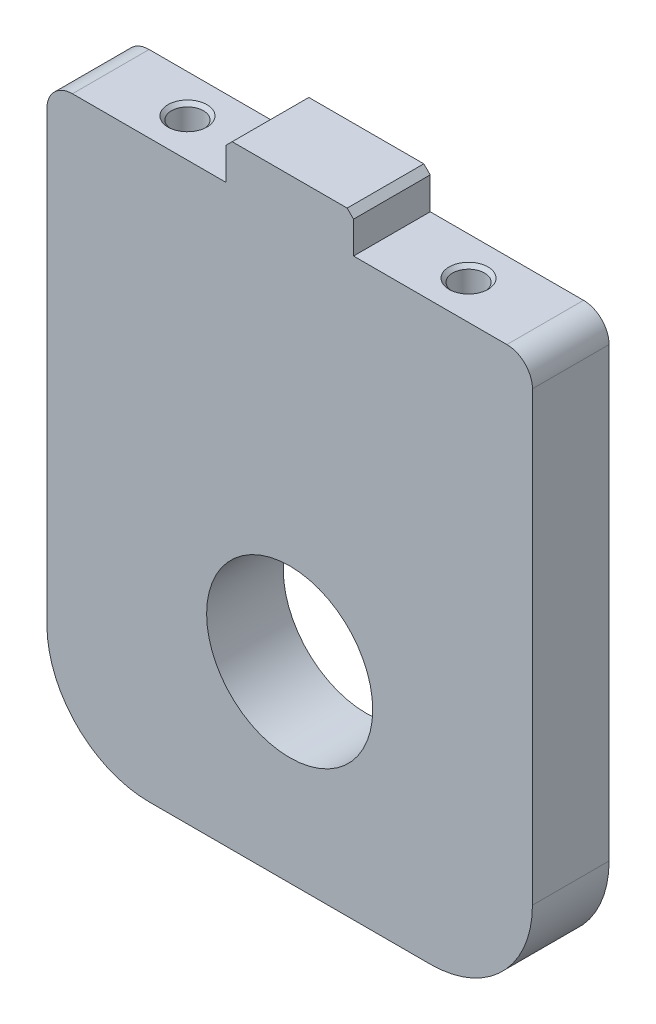
from build123d import *

# Parameters (mm, degrees)
SKETCH_1_W                   = 38
SKETCH_1_H                   = 45
EXTRUDE_1_DEPTH              = 6
SKETCH_2_R                   = 6.5
CUT_EXTRUDE_1_DEPTH          = 31.054117854
FILLET_1_R                   = 2
FILLET_2_R                   = 8
SKETCH_3_W                   = 10
SKETCH_3_H                   = 3
EXTRUDE_2_DEPTH              = 6
CHAMFER_1_SIZE               = 0.5
HOLE_WIZARD_M3_1_D           = 2.5
HOLE_WIZARD_M3_1_DEPTH       = 7.5
HOLE_WIZARD_M3_1_CSINK_D     = 3.05
HOLE_WIZARD_M3_1_CSINK_ANGLE = 90
HOLE_WIZARD_M3_1_TIP         = 0.751075774


with BuildPart() as part:
    # 草图1 → 凸台-拉伸1 (new body)
    with BuildSketch(Plane.XY):
        Rectangle(SKETCH_1_W, SKETCH_1_H)
    extrude(amount=EXTRUDE_1_DEPTH)

    # 草图2 → 切除-拉伸1 (cut, through all)
    with BuildSketch(Plane.XY.offset(6)):
        with Locations((0, -7.5)):
            Circle(SKETCH_2_R)
    extrude(amount=-CUT_EXTRUDE_1_DEPTH, mode=Mode.SUBTRACT)

    # 圆角1
    fillet_1_edges = [part.edges().sort_by_distance(p)[0] for p in [
        (-19, 22.5, 3),
        (19, 22.5, 3),
    ]]
    fillet(fillet_1_edges, radius=FILLET_1_R)

    # 圆角2
    fillet_2_edges = [part.edges().sort_by_distance(p)[0] for p in [
        (19, -22.5, 3),
        (-19, -22.5, 3),
    ]]
    fillet(fillet_2_edges, radius=FILLET_2_R)

    # 草图3 → 凸台-拉伸2 (add)
    with BuildSketch(Plane.XY.offset(6)):
        with Locations((0, 24)):
            Rectangle(SKETCH_3_W, SKETCH_3_H)
    extrude(amount=-EXTRUDE_2_DEPTH)

    # 倒角1
    chamfer_1_edges = [part.edges().sort_by_distance(p)[0] for p in [
        (-5, 25.5, 3),
        (5, 25.5, 3),
    ]]
    chamfer(chamfer_1_edges, length=CHAMFER_1_SIZE)

    # M3 螺纹孔1
    with Locations(Plane(origin=(-11, 22.5, 3), x_dir=(0, 0, 1), z_dir=(0, 1, 0))):
        with Locations((0, 0), (0, 22)):
            CounterSinkHole(HOLE_WIZARD_M3_1_D / 2, HOLE_WIZARD_M3_1_CSINK_D / 2, depth=HOLE_WIZARD_M3_1_DEPTH, counter_sink_angle=HOLE_WIZARD_M3_1_CSINK_ANGLE)
            with Locations((0, 0, -(HOLE_WIZARD_M3_1_DEPTH + HOLE_WIZARD_M3_1_TIP / 2))):  # 118° drill point
                Cone(0, HOLE_WIZARD_M3_1_D / 2, HOLE_WIZARD_M3_1_TIP, mode=Mode.SUBTRACT)


solid = part.part
